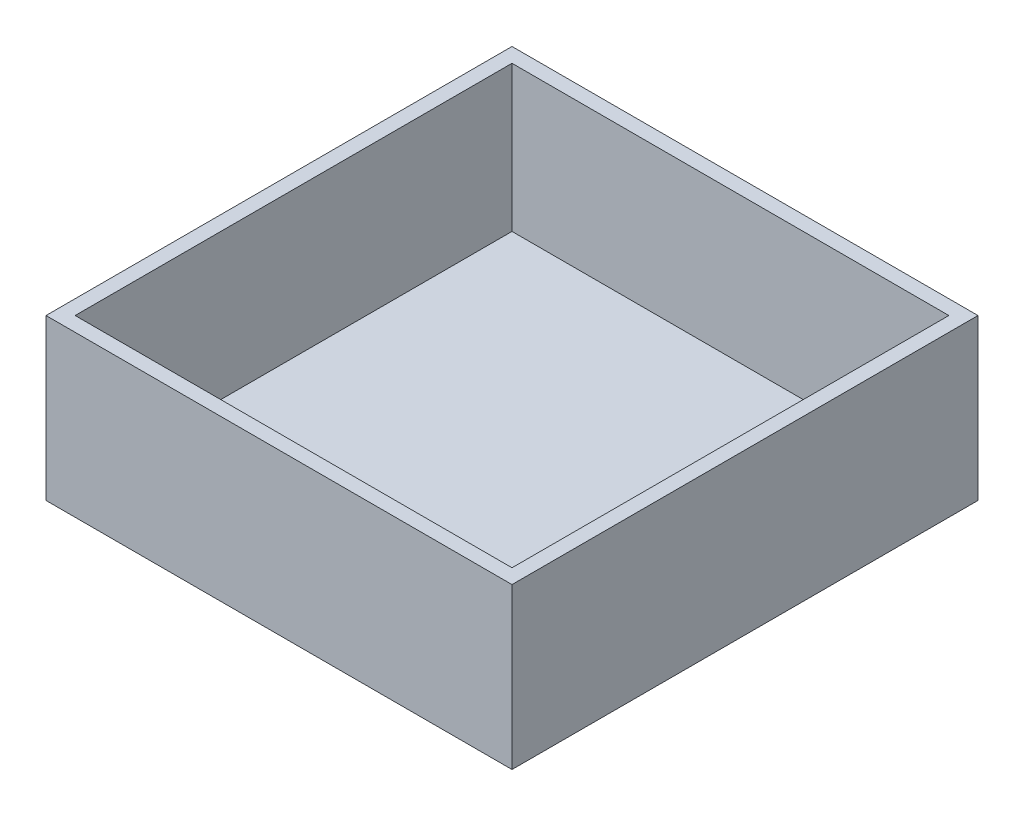
from build123d import *

# Parameters (mm, degrees)
ESQUISSE1_W        = 150
ESQUISSE1_H        = 150
BOSS_EXTRU_1_DEPTH = 50
COQUE1_T           = 5


with BuildPart() as part:
    # Esquisse1 → Boss.-Extru.1 (new body)
    with BuildSketch(Plane(origin=(0, 0, 0), x_dir=(1, 0, 0), z_dir=(0, 1, 0))):
        Rectangle(ESQUISSE1_W, ESQUISSE1_H)
    extrude(amount=BOSS_EXTRU_1_DEPTH)

    # Coque1
    coque1_openings = [part.faces().sort_by_distance(p)[0] for p in [
        (0, 50, 0),
    ]]
    offset(amount=COQUE1_T, openings=coque1_openings, kind=Kind.INTERSECTION)


solid = part.part
